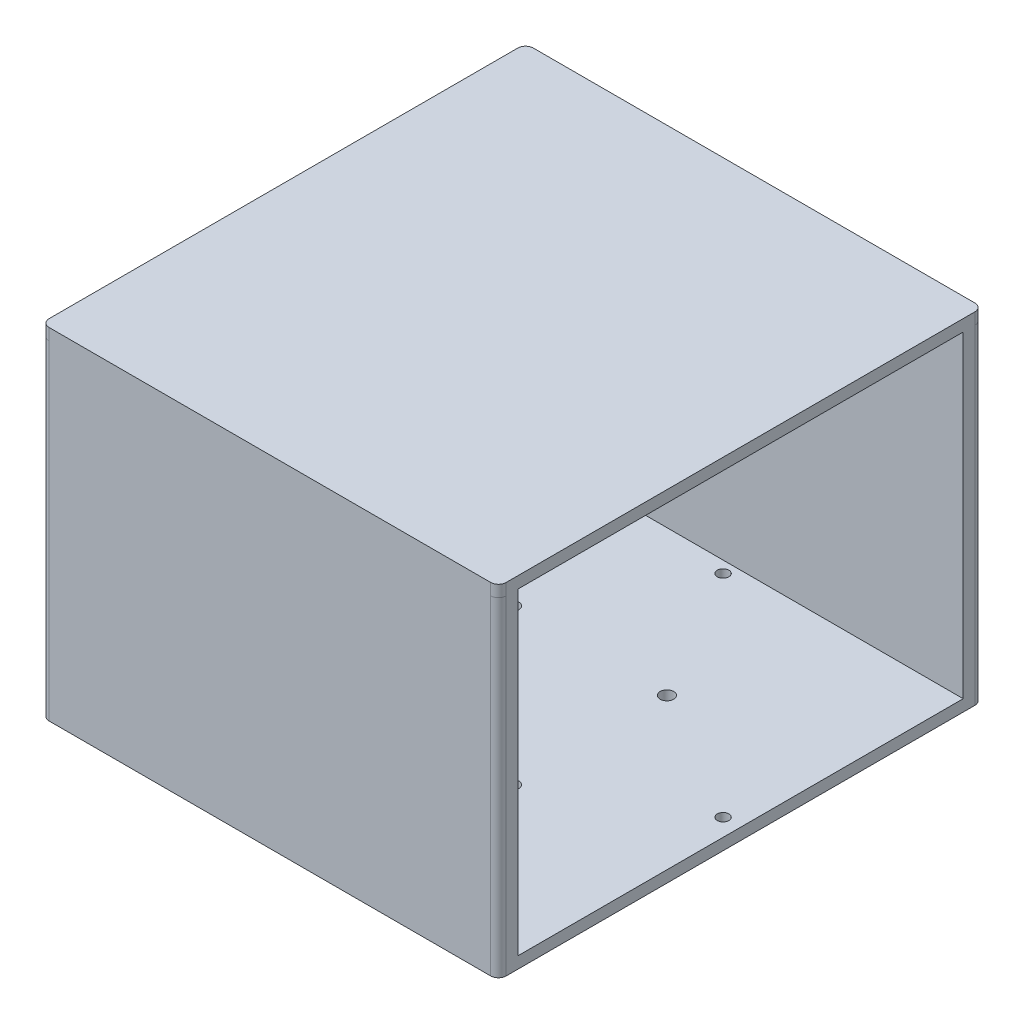
from build123d import *

# Parameters (mm, degrees)
SKETCH_1_W          = 118
SKETCH_1_H          = 125
SKETCH_1_R          = 1.5
EXTRUDE_1_DEPTH     = 3
SKETCH_5_R          = 1.75
CUT_EXTRUDE_1_DEPTH = 10
SKETCH_6_W          = 118
SKETCH_6_H          = 5
EXTRUDE_4_DEPTH     = 82
FILLET_1_R          = 2
SKETCH_7_W          = 118
SKETCH_7_H          = 125
EXTRUDE_5_DEPTH     = 3
FILLET_2_R          = 2


with BuildPart() as part:
    # 草图1 → 凸台-拉伸1 (new body)
    with BuildSketch(Plane(origin=(0, 0, 0), x_dir=(1, 0, 0), z_dir=(0, 1, 0))):
        Rectangle(SKETCH_1_W, SKETCH_1_H)
        with Locations(Location((-54.5, 0, 0), (0, 0, 270))):
            Circle(SKETCH_1_R, mode=Mode.SUBTRACT)
        with Locations(Location((0, 54.5, 0), (0, 0, 270))):
            Circle(SKETCH_1_R, mode=Mode.SUBTRACT)
        with Locations(Location((54.5, 0, 0), (0, 0, 270))):
            Circle(SKETCH_1_R, mode=Mode.SUBTRACT)
        with Locations(Location((0, -54.5, 0), (0, 0, 270))):
            Circle(SKETCH_1_R, mode=Mode.SUBTRACT)
    extrude(amount=EXTRUDE_1_DEPTH)

    # 草图5 → 切除-拉伸1 (cut)
    with BuildSketch(Plane(origin=(0, 0, 0), x_dir=(-1, 0, 0), z_dir=(0, -1, 0))):
        with Locations(Location((20, 20, 0), (0, 0, 90))):
            Circle(SKETCH_5_R)
        with Locations(Location((-20, 20, 0), (0, 0, 90))):
            Circle(SKETCH_5_R)
        with Locations(Location((-20, -20, 0), (0, 0, 90))):
            Circle(SKETCH_5_R)
        with Locations(Location((20, -20, 0), (0, 0, 90))):
            Circle(SKETCH_5_R)
    extrude(amount=-CUT_EXTRUDE_1_DEPTH, mode=Mode.SUBTRACT)

    # 草图6 → 凸台-拉伸4 (add)
    with BuildSketch(Plane(origin=(0, 3, 0), x_dir=(1, 0, 0), z_dir=(0, 1, 0))):
        with Locations((0, -60)):
            Rectangle(SKETCH_6_W, SKETCH_6_H)
        with Locations((0, 60)):
            Rectangle(SKETCH_6_W, SKETCH_6_H)
    extrude(amount=EXTRUDE_4_DEPTH)

    # 圆角1
    fillet_1_edges = [part.edges().sort_by_distance(p)[0] for p in [
        (-59, 42.5, -62.5),
        (59, 42.5, -62.5),
        (59, 42.5, 62.5),
        (-59, 42.5, 62.5),
    ]]
    fillet(fillet_1_edges, radius=FILLET_1_R)

    # 草图7 → 凸台-拉伸5 (add)
    with BuildSketch(Plane(origin=(0, 85, 0), x_dir=(1, 0, 0), z_dir=(0, 1, 0))):
        Rectangle(SKETCH_7_W, SKETCH_7_H)
    extrude(amount=EXTRUDE_5_DEPTH)

    # 圆角2
    fillet_2_edges = [part.edges().sort_by_distance(p)[0] for p in [
        (-59, 86.5, -62.5),
        (59, 86.5, -62.5),
        (-59, 86.5, 62.5),
        (59, 86.5, 62.5),
    ]]
    fillet(fillet_2_edges, radius=FILLET_2_R)


solid = part.part
